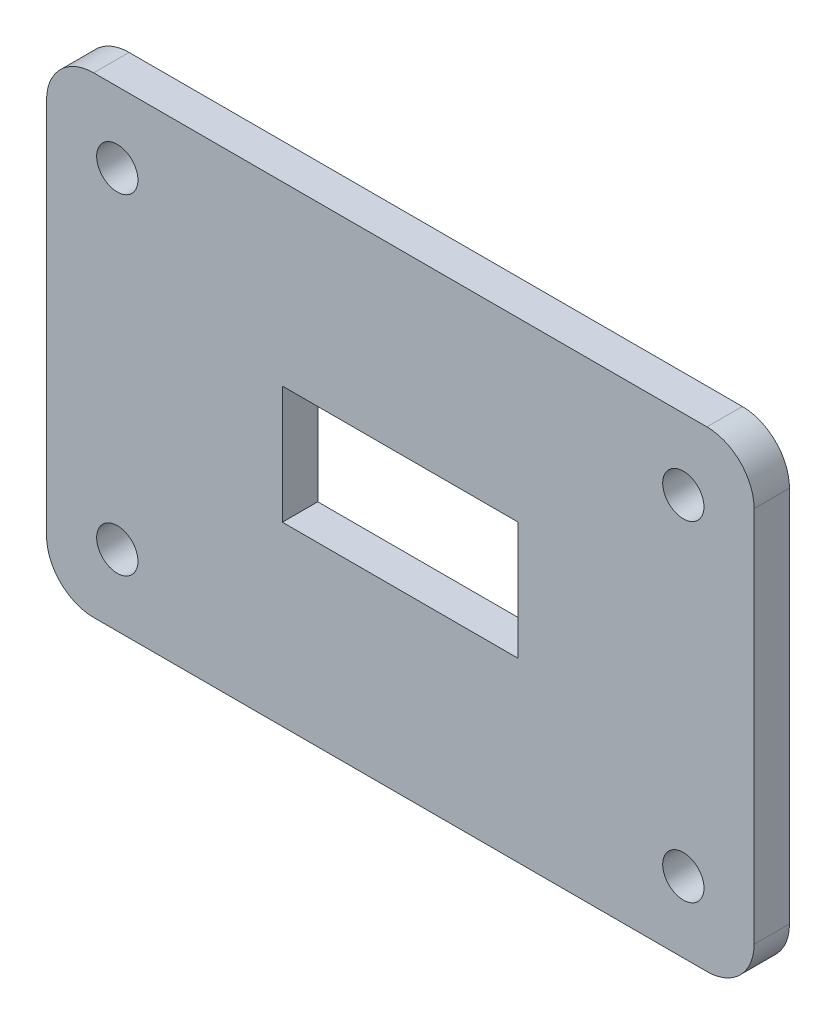
from build123d import *

# Parameters (mm, degrees)
EXTRUDE_1_DEPTH     = 6
SKETCH_2_R          = 3.5
CUT_EXTRUDE_1_DEPTH = 73.360210061
SKETCH_3_W          = 40
SKETCH_3_H          = 20
CUT_EXTRUDE_2_DEPTH = 121


with BuildPart() as part:
    # 草图1 → 凸台-拉伸1 (new body)
    with BuildSketch(Plane.XY):
        with BuildLine():
            Line((-52, -40), (52, -40))
            ThreePointArc((52, -40), (57.656854249, -37.656854249), (60, -32))
            Line((60, -32), (60, 32))
            ThreePointArc((60, 32), (57.656854249, 37.656854249), (52, 40))
            Line((52, 40), (-52, 40))
            ThreePointArc((-52, 40), (-57.656854249, 37.656854249), (-60, 32))
            Line((-60, 32), (-60, -32))
            ThreePointArc((-60, -32), (-57.656854249, -37.656854249), (-52, -40))
        make_face()
    extrude(amount=EXTRUDE_1_DEPTH)

    # 草图2 → 切除-拉伸1 (cut, through all)
    with BuildSketch(Plane.XY):
        with Locations((-48, -28)):
            Circle(SKETCH_2_R)
        with Locations((-48, 28)):
            Circle(SKETCH_2_R)
        with Locations((48, -28)):
            Circle(SKETCH_2_R)
        with Locations((48, 28)):
            Circle(SKETCH_2_R)
    extrude(amount=CUT_EXTRUDE_1_DEPTH, mode=Mode.SUBTRACT)

    # 草图3 → 切除-拉伸2 (cut, symmetric)
    with BuildSketch(Plane.XY):
        Rectangle(SKETCH_3_W, SKETCH_3_H)
    extrude(amount=CUT_EXTRUDE_2_DEPTH, both=True, mode=Mode.SUBTRACT)


solid = part.part
